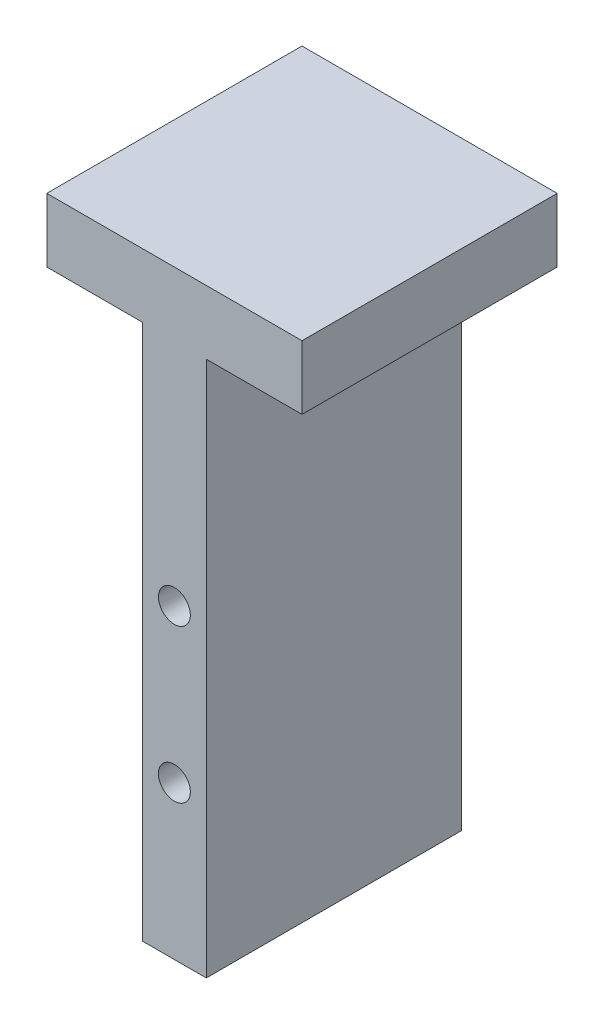
from build123d import *

# Parameters (mm, degrees)
SKETCH_1_W                  = 20
SKETCH_1_H                  = 20
EXTRUDE_1_DEPTH             = 5
SKETCH_2_W                  = 5
SKETCH_2_H                  = 20
EXTRUDE_2_DEPTH             = 35
HOLE_WIZARD_M3_1_AT_2_COUNT = 2
HOLE_WIZARD_M3_1_AT_2_PITCH = 12
SKETCH_5_W                  = 5
SKETCH_5_H                  = 20
EXTRUDE_3_DEPTH             = 7


with BuildPart() as part:
    # 草圖1 → 填料-伸長1 (new body)
    with BuildSketch(Plane(origin=(0, 0, 0), x_dir=(1, 0, 0), z_dir=(0, 1, 0))):
        Rectangle(SKETCH_1_W, SKETCH_1_H)
    extrude(amount=EXTRUDE_1_DEPTH)

    # 草圖2 → 填料-伸長2 (add)
    with BuildSketch(Plane.XZ):
        Rectangle(SKETCH_2_W, SKETCH_2_H)
    extrude(amount=EXTRUDE_2_DEPTH)

    # 草圖4 → M3 螺紋孔1 (revolve, cut)
    with BuildSketch(Plane(origin=(0, -18, 10), x_dir=(0, -1, 0), z_dir=(1, 0, 0))):
        Polygon((0, 0), (0, 7.251075774), (1.25, 6.5), (1.25, 0), align=None)
    hole_wizard_m3_1 = revolve(axis=Axis((0, -18, 16.35), (0, 0, -1)), mode=Mode.SUBTRACT)

    # M3 螺紋孔1 at 2: M3 螺紋孔1 ×2
    with Locations(*[(0, -i * HOLE_WIZARD_M3_1_AT_2_PITCH, 0) for i in range(1, HOLE_WIZARD_M3_1_AT_2_COUNT)]):
        add(hole_wizard_m3_1, mode=Mode.SUBTRACT)

    # 鏡射1: M3 螺紋孔1 across plane
    add(hole_wizard_m3_1.mirror(Plane.XY), mode=Mode.SUBTRACT)

    # 鏡射1 copy 1 sketch → 鏡射1 copy 1 (revolve, cut)
    with BuildSketch(Plane(origin=(0, -30, -10), x_dir=(0, -1, 0), z_dir=(1, 0, 0))):
        Polygon((0, 0), (0, -7.251075774), (1.25, -6.5), (1.25, 0), align=None)
    revolve(axis=Axis((0, -30, -16.35), (0, 0, -1)), mode=Mode.SUBTRACT)

    # 草圖5 → 填料-伸長3 (add)
    with BuildSketch(Plane.XZ.offset(35)):
        Rectangle(SKETCH_5_W, SKETCH_5_H)
    extrude(amount=EXTRUDE_3_DEPTH)


solid = part.part
